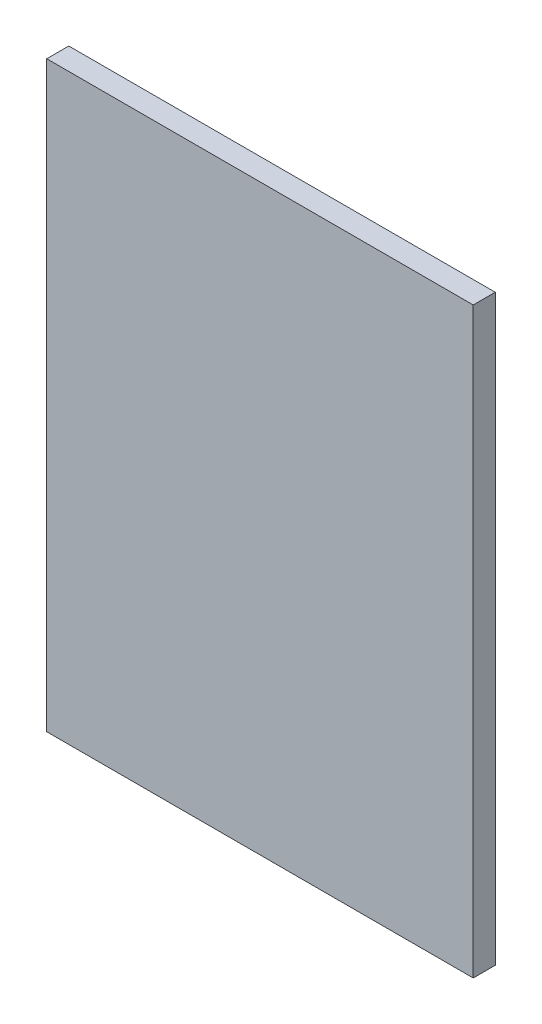
from build123d import *

# Parameters (mm, degrees)
ESQUISSE1_W        = 30
ESQUISSE1_H        = 41
BOSS_EXTRU_1_DEPTH = 1.55


with BuildPart() as part:
    # Esquisse1 → Boss.-Extru.1 (new body)
    with BuildSketch(Plane.XY):
        Rectangle(ESQUISSE1_W, ESQUISSE1_H)
    extrude(amount=BOSS_EXTRU_1_DEPTH)


solid = part.part
